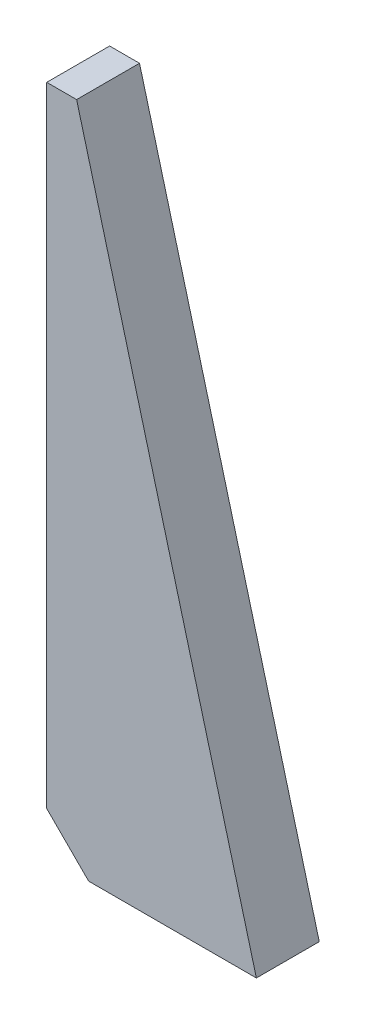
from build123d import *

# Parameters (mm, degrees)
EXTRUDE_1_DEPTH = 15
CHAMFER_1_SIZE  = 10


with BuildPart() as part:
    # 草圖1 → 填料-伸長1 (new body)
    with BuildSketch(Plane.XY):
        Polygon((0, 0), (0, 160), (7.128129211, 160), (50, 0), align=None)
    extrude(amount=EXTRUDE_1_DEPTH)

    # 導角1
    chamfer_1_edges = [part.edges().sort_by_distance(p)[0] for p in [
        (0, 0, 7.5),
    ]]
    chamfer(chamfer_1_edges, length=CHAMFER_1_SIZE)


solid = part.part
